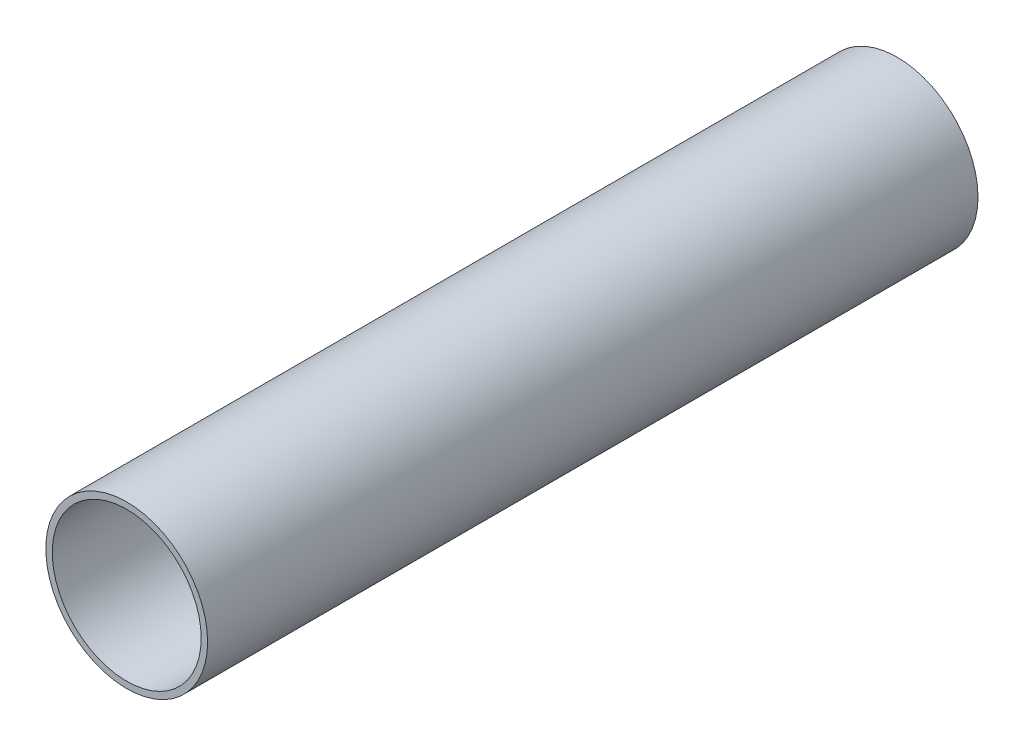
from build123d import *

# Parameters (mm, degrees)
ESQUISSE1_R        = 31.5
ESQUISSE1_R_2      = 29
BOSS_EXTRU_1_DEPTH = 300


with BuildPart() as part:
    # Esquisse1 → Boss.-Extru.1 (new body)
    with BuildSketch(Plane.XY):
        Circle(ESQUISSE1_R)
        Circle(ESQUISSE1_R_2, mode=Mode.SUBTRACT)
    extrude(amount=BOSS_EXTRU_1_DEPTH)


solid = part.part
